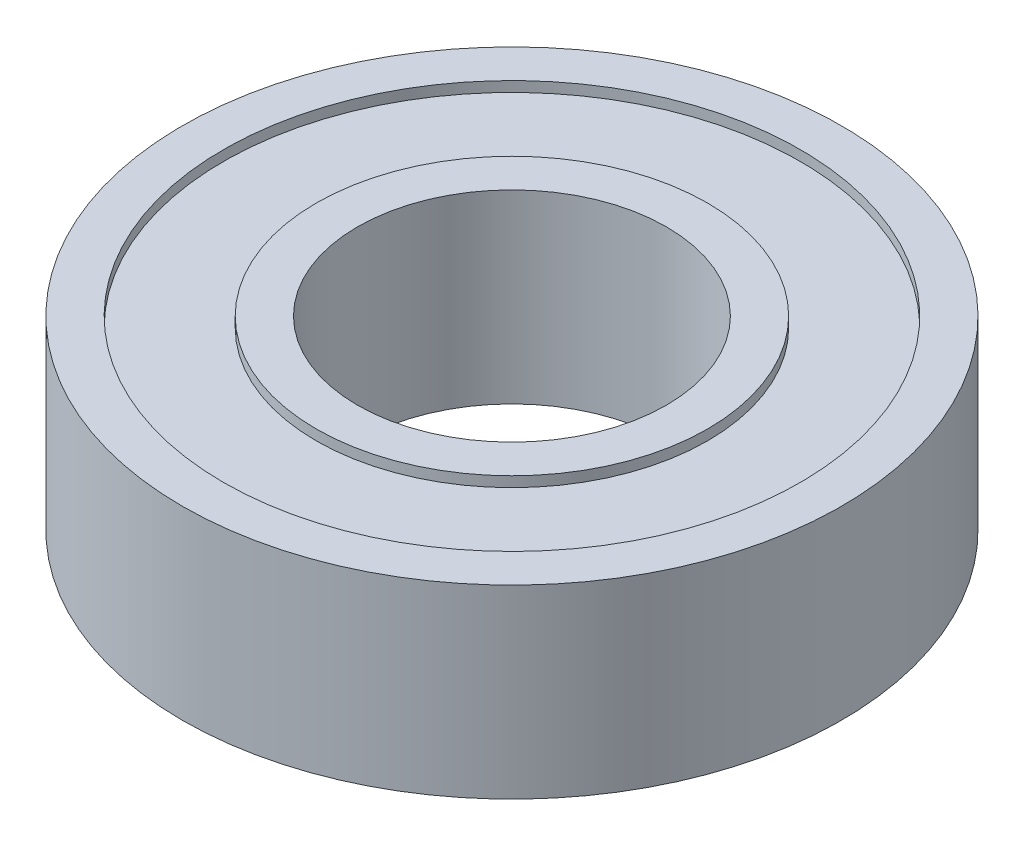
from build123d import *

# Parameters (mm, degrees)
ESBO_O1_W = 2
ESBO_O1_H = 9
ESBO_O2_W = 4.5
ESBO_O2_H = 8


with BuildPart() as part:
    # Esboço1 → Revolução1 (revolve)
    with BuildSketch(Plane.XY, mode=Mode.PRIVATE) as revolu_o1_sk:
        with Locations((8.5, 0)):
            Rectangle(ESBO_O1_W, ESBO_O1_H)
        with Locations((15, 0)):
            Rectangle(ESBO_O1_W, ESBO_O1_H)
    revolve(revolu_o1_sk.sketch.rotate(Axis((0, 23.502828235, 0), (0, -1, 0)), 90), axis=Axis((0, 23.502828235, 0), (0, -1, 0)))

    # Esboço2 → Revolução2 (revolve)
    with BuildSketch(Plane.XY, mode=Mode.PRIVATE) as revolu_o2_sk:
        with Locations((-11.75, 0)):
            Rectangle(ESBO_O2_W, ESBO_O2_H)
    revolve(revolu_o2_sk.sketch.rotate(Axis((0, 7.620347907, 0), (0, -1, 0)), 270), axis=Axis((0, 7.620347907, 0), (0, -1, 0)))


solid = part.part
